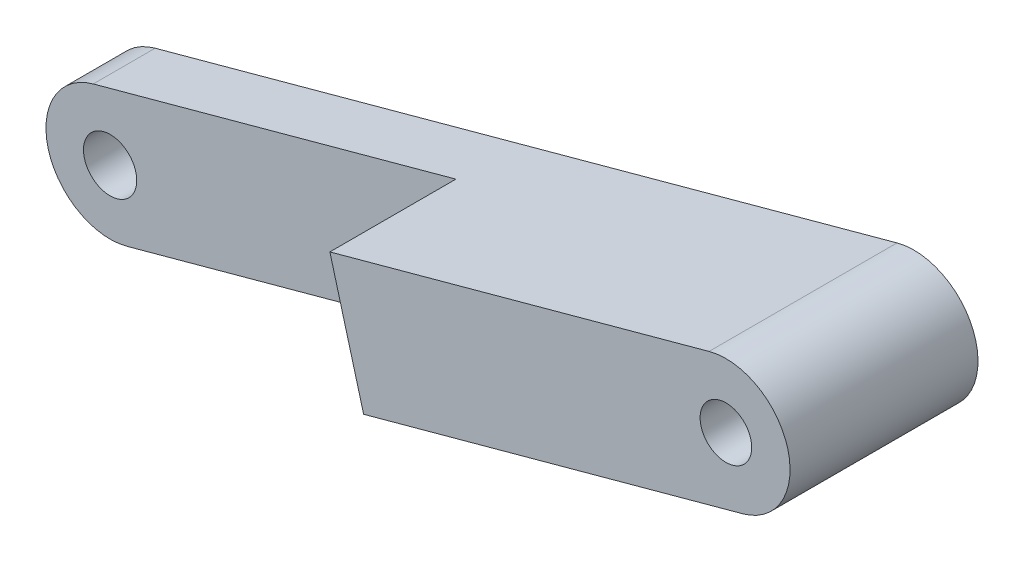
from build123d import *

# Parameters (mm, degrees)
ESQUISSE1_R             = 1.558671709
ESQUISSE1_R_2           = 1.510734584
BOSS_EXTRU_1_DEPTH      = 11
ESQUISSE2_W             = 30
ESQUISSE2_H             = 7.376780582
ENL_V_MAT_EXTRU_1_DEPTH = 10


with BuildPart() as part:
    # Esquisse1 → Boss.-Extru.1 (new body)
    with BuildSketch(Plane.XY):
        with BuildLine():
            Line((-27.586844937, 4.788639913), (15.827697586, 16.628297741))
            ThreePointArc((15.827697586, 16.628297741), (20.43658301, 13.99456085), (17.802846119, 9.385675426))
            Line((17.802846119, 9.385675426), (-25.611696404, -2.453982402))
            ThreePointArc((-25.611696404, -2.453982402), (-30.220581828, 0.179754489), (-27.586844937, 4.788639913))
        make_face()
        with Locations((-26.599270671, 1.167328755)):
            Circle(ESQUISSE1_R, mode=Mode.SUBTRACT)
        with Locations((16.815271853, 13.006986583)):
            Circle(ESQUISSE1_R_2, mode=Mode.SUBTRACT)
    extrude(amount=BOSS_EXTRU_1_DEPTH)

    # Esquisse2 → Enlèv. mat.-Extru.1 (cut)
    with BuildSketch(Plane(origin=(-3.125175124, 11.4596258, 0), x_dir=(0.9647676116315722, 0.2631035072869839, 0), z_dir=(-0.2631035072869839, 0.9647676116315722, 0))):
        with Locations((-18.354986546, -7.311609709)):
            Rectangle(ESQUISSE2_W, ESQUISSE2_H)
    extrude(amount=-ENL_V_MAT_EXTRU_1_DEPTH, mode=Mode.SUBTRACT)


solid = part.part
